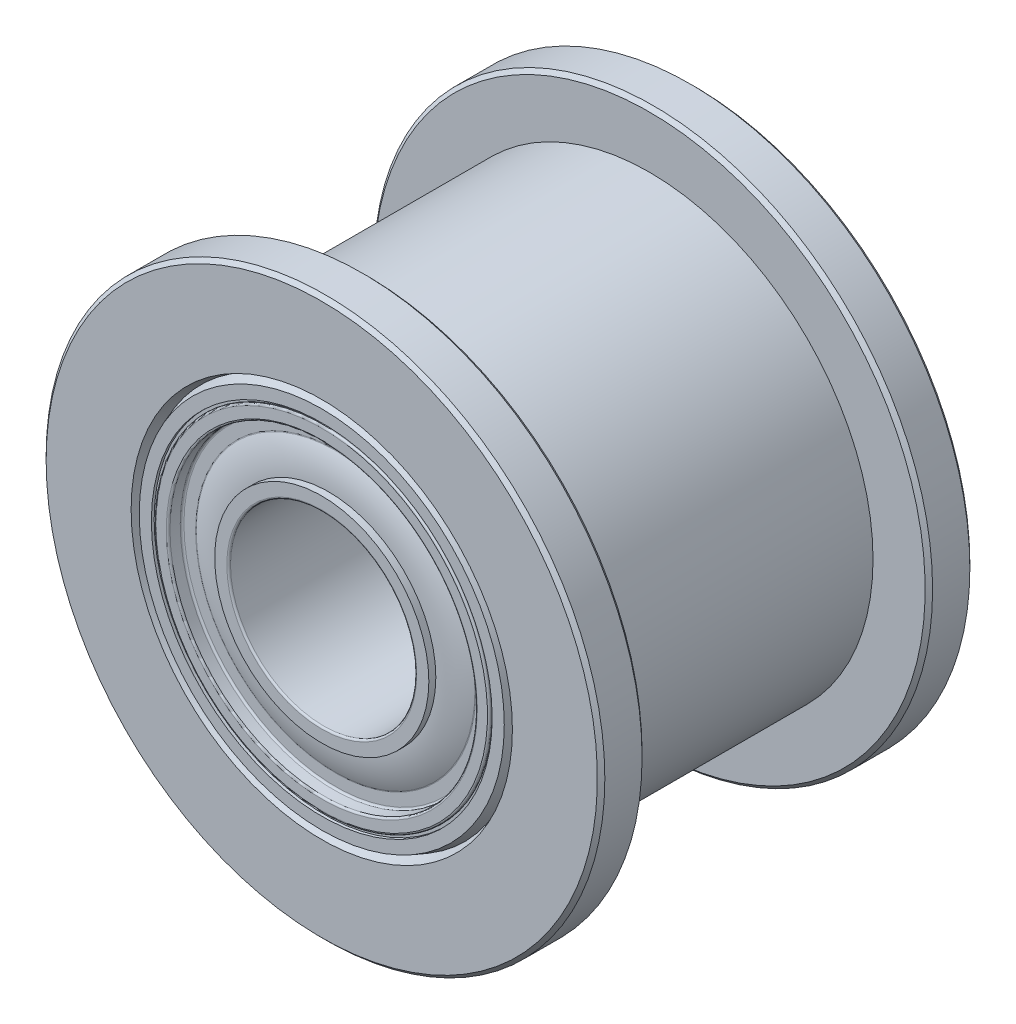
from build123d import *

# Parameters (mm, degrees)
CHAMFER1_SIZE = 0.1
FILLET2_R     = 0.05


with BuildPart() as part:
    # Sketch2 → Revolve1 (revolve)
    with BuildSketch(Plane(origin=(0, 0, 0), x_dir=(0, 0, -1), z_dir=(1, 0, 0)), mode=Mode.PRIVATE) as revolve1_sk:
        with BuildLine():
            Line((5, 2.5), (0, 2.5))
            Line((0, 2.5), (0, 4.5))
            Line((0, 4.5), (5, 4.5))
            Line((5, 4.5), (5, 4.125))
            Line((5, 4.125), (4.625, 4.125))
            Line((4.625, 4.125), (4.625, 3.75))
            ThreePointArc((4.625, 3.75), (4.765098905, 3.322431908), (4.8125, 2.875))
            Line((4.8125, 2.875), (5, 2.875))
            Line((5, 2.875), (5, 2.5))
        make_face()
    revolve(revolve1_sk.sketch.rotate(Axis((0, 0, 5), (0, 0, -1)), 90), axis=Axis((0, 0, 5), (0, 0, -1)))

    # Mirror1: part across plane


with BuildPart() as part_1:
    add(part.part)
    add(part.part.mirror(Plane.XY))

    # Fillet2
    fillet2_edges = [part_1.edges().sort_by_distance(p)[0] for p in [
        (-2.5, 0, -5),
        (-2.5, 0, 5),
        (-4.5, 0, 5),
        (-4.125, 0, 5),
        (-4.125, 0, 4.625),
        (-3.75, 0, 4.625),
        (-2.875, 0, -5),
        (-3.75, 0, -4.625),
        (-4.125, 0, -5),
        (-4.5, 0, -5),
    ]]
    fillet(fillet2_edges, radius=FILLET2_R)


with BuildPart() as body_2:
    # Sketch3 → Revolve2 (revolve)
    with BuildSketch(Plane(origin=(0, 0, 0), x_dir=(0, 0, -1), z_dir=(1, 0, 0)), mode=Mode.PRIVATE) as revolve2_sk:
        Polygon((3.8, 7.5), (5, 7.5), (5, 5.118382141), (4.7, 5.00919107), (5, 4.9), (5, 4.575), (4.925, 4.575), (4.925, 4.5), (-4.925, 4.5), (-4.925, 4.575), (-5, 4.575), (-5, 4.9), (-4.7, 5.00919107), (-5, 5.118382141), (-5, 7.5), (-3.8, 7.5), (-3.8, 6), (3.8, 6), align=None)
    revolve(revolve2_sk.sketch.rotate(Axis((0, 0, 5), (0, 0, -1)), 90), axis=Axis((0, 0, 5), (0, 0, -1)))

    # Chamfer1
    chamfer1_edges = [body_2.edges().sort_by_distance(p)[0] for p in [
        (-7.5, 0, 3.8),
        (-7.5, 0, 5),
        (-7.5, 0, -5),
        (-7.5, 0, -3.8),
    ]]
    chamfer(chamfer1_edges, length=CHAMFER1_SIZE)

    # Combine1: union part
    add(part_1.part)


solid = body_2.part
